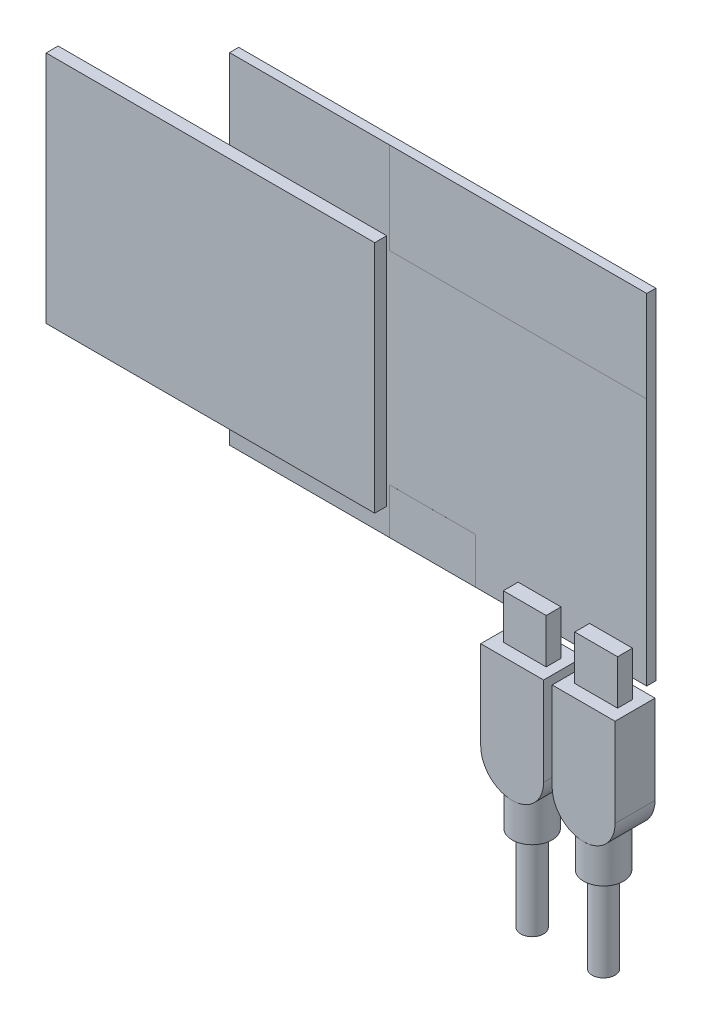
from build123d import *

# Parameters (mm, degrees)
SKETCH1_W                = 73
SKETCH1_H                = 59.5
GREEN_PCB_DEPTH          = 1.6
SKETCH2_W                = 57.5
SKETCH2_H                = 41
BLUE_PCB_DEPTH           = 2.1
SKETCH3_W                = 45
SKETCH3_H                = 16
SKETCH3_W_2              = 15
SKETCH3_H_2              = 8
CLAMP_AREA_DEPTH         = 0.001
SKETCH4_W                = 7.5
SKETCH4_H                = 7.8
USB_PORT_DEPTH           = 2.6
USB_BODY_DEPTH           = 3.5
SKETCH7_R                = 3.5
USB_TENSION_RELIEF_DEPTH = 6
SKETCH8_R                = 2
USB_CORD_DEPTH           = 15
SKETCH9_R                = 5.5
MONA_LISA_ANTENNA_DEPTH  = 0.001
LPATTERN1_COUNT          = 2
LPATTERN1_PITCH          = 20.5
LPATTERN2_COUNT          = 2
LPATTERN2_PITCH          = 12.5


with BuildPart() as part:
    # Sketch1 → Green PCB (new body)
    with BuildSketch(Plane.XY):
        with Locations((-36.5, 29.75)):
            Rectangle(SKETCH1_W, SKETCH1_H)
    extrude(amount=GREEN_PCB_DEPTH)

    # Sketch2 → Blue PCB (add)
    with BuildSketch(Plane.XY.offset(1.6)):
        with Locations((-74.25, 25)):
            Rectangle(SKETCH2_W, SKETCH2_H)
    extrude(amount=BLUE_PCB_DEPTH)

    # Sketch3 → Clamp Area (add)
    with BuildSketch(Plane.XY.offset(1.6)):
        with Locations((-22.5, 51.5)):
            Rectangle(SKETCH3_W, SKETCH3_H)
        with Locations((-37.5, 4)):
            Rectangle(SKETCH3_W_2, SKETCH3_H_2)
    extrude(amount=CLAMP_AREA_DEPTH)

    # Sketch4 → USB Port (add)
    with BuildSketch(Plane.XY.offset(1.6)):
        with Locations((-6.25, 0.6)):
            Rectangle(SKETCH4_W, SKETCH4_H)
    usb_port = extrude(amount=USB_PORT_DEPTH)

    # Sketch5 → USB Body (add, symmetric)
    with BuildSketch(Plane.XY.offset(2.9)):
        with BuildLine():
            Line((-11.75, -3.3), (-0.75, -3.3))
            Line((-0.75, -3.3), (-0.75, -18.8))
            ThreePointArc((-0.75, -18.8), (-6.25, -24.3), (-11.75, -18.8))
            Line((-11.75, -18.8), (-11.75, -3.3))
        make_face()
    usb_body = extrude(amount=USB_BODY_DEPTH, both=True)

    # Sketch7 → USB Tension Relief (add, symmetric)
    with BuildSketch(Plane(origin=(0, -24.3, 0), x_dir=(-1, 0, 0), z_dir=(0, -1, 0))):
        with Locations(Location((6.25, -2.9, 0), (0, 0, 90))):
            Circle(SKETCH7_R)
    usb_tension_relief = extrude(amount=USB_TENSION_RELIEF_DEPTH, both=True)

    # Sketch8 → USB Cord (add)
    with BuildSketch(Plane.XZ.offset(30.3)):
        with Locations(Location((-6.25, 2.9, 0), (0, 0, 270))):
            Circle(SKETCH8_R)
    usb_cord = extrude(amount=USB_CORD_DEPTH)

    # Sketch9 → Mona Lisa Antenna (add)
    with BuildSketch(Plane(origin=(0, 0, 1.6), x_dir=(-1, 0, 0), z_dir=(0, 0, -1))):
        with Locations(Location((88.2, 35.25, 0), (0, 0, 180))):
            Circle(SKETCH9_R)
        Polygon((85.066571319, 38.121258382), (89.389314163, 36.547908657), (91.333428681, 32.378741618), (87.010685837, 33.952091343), align=None, mode=Mode.SUBTRACT)
    mona_lisa_antenna = extrude(amount=MONA_LISA_ANTENNA_DEPTH)

    # LPattern1: Mona Lisa Antenna ×2
    with Locations(*[(0, -i * LPATTERN1_PITCH, 0) for i in range(1, LPATTERN1_COUNT)]):
        add(mona_lisa_antenna)

    # LPattern2: USB Port, USB Body, USB Tension Relief, USB Cord ×2
    with Locations(*[(-i * LPATTERN2_PITCH, 0, 0) for i in range(1, LPATTERN2_COUNT)]):
        add(usb_port)
        add(usb_body)
        add(usb_tension_relief)
        add(usb_cord)


solid = part.part
